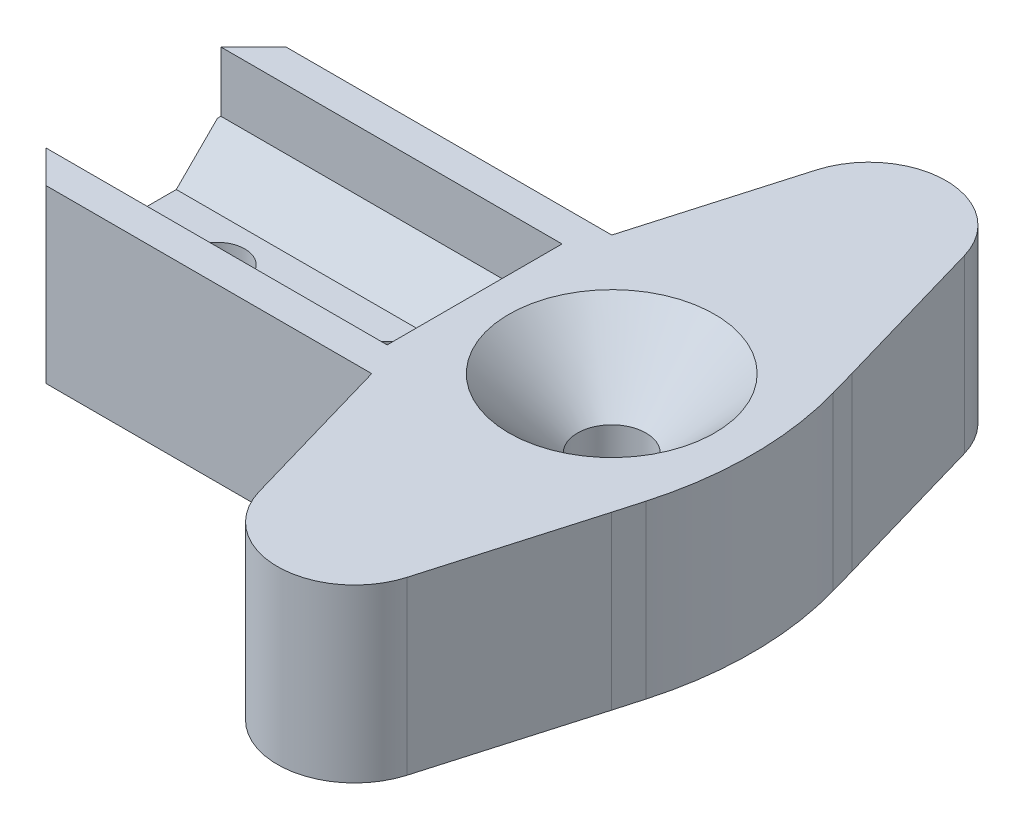
from build123d import *

# Parameters (mm, degrees)
ESQUISSE1_R             = 2
BOSS_EXTRU_1_DEPTH      = 10
ESQUISSE2_W             = 10.2
ESQUISSE2_H             = 6
ENL_V_MAT_EXTRU_1_DEPTH = 20
CHANFREIN1_SIZE         = 2.5
CHANFREIN2_SIZE         = 1.8
ESQUISSE5_R             = 1.6
ENL_V_MAT_EXTRU_4_DEPTH = 7
CHANFREIN4_SIZE         = 2.1
CHANFREIN5_SIZE         = 2
ENL_V_MAT_EXTRU_5_DEPTH = 4
CHANFREIN6_SIZE         = 4
CONG_1_R                = 20


with BuildPart() as part:
    # Esquisse1 → Boss.-Extru.1 (new body)
    with BuildSketch(Plane(origin=(0, 0, 0), x_dir=(1, 0, 0), z_dir=(0, 1, 0))):
        with BuildLine():
            Line((-28, -7), (-7, -7))
            Line((-7, -7), (-4.322606063, -16.251030305))
            ThreePointArc((-4.322606063, -16.251030305), (0, -19.5), (4.322606063, -16.251030305))
            Line((4.322606063, -16.251030305), (7, -7))
            Line((7, -7), (8.983874701, 0))
            Line((8.983874701, 0), (7, 7))
            Line((7, 7), (4.322606063, 16.251030305))
            ThreePointArc((4.322606063, 16.251030305), (0, 19.5), (-4.322606063, 16.251030305))
            Line((-4.322606063, 16.251030305), (-7, 7))
            Line((-7, 7), (-28, 7))
            Line((-28, 7), (-28, -7))
        make_face()
        with Locations(Location((0, 0, 0), (0, 0, 270))):
            Circle(ESQUISSE1_R, mode=Mode.SUBTRACT)
    extrude(amount=BOSS_EXTRU_1_DEPTH)

    # Esquisse2 → Enlèv. mat.-Extru.1 (cut)
    with BuildSketch(Plane.ZY.offset(28)):
        with Locations((0, 7)):
            Rectangle(ESQUISSE2_W, ESQUISSE2_H)
    extrude(amount=-ENL_V_MAT_EXTRU_1_DEPTH, mode=Mode.SUBTRACT)

    # Chanfrein1
    chanfrein1_edges = [part.edges().sort_by_distance(p)[0] for p in [
        (-18, 4, -5.1),
        (-18, 4, 5.1),
    ]]
    chamfer(chanfrein1_edges, length=CHANFREIN1_SIZE)

    # Chanfrein2
    chanfrein2_edges = [part.edges().sort_by_distance(p)[0] for p in [
        (-8, 4, 0),
        (-8, 5.25, -3.85),
        (-8, 5.25, 3.85),
    ]]
    chamfer(chanfrein2_edges, length=CHANFREIN2_SIZE)

    # Esquisse5 → Enlèv. mat.-Extru.4 (cut)
    with BuildSketch(Plane.XZ):
        with Locations(Location((-23, 0, 0), (0, 0, 270))):
            Circle(ESQUISSE5_R)
        with Locations(Location((-13, 0, 0), (0, 0, 270))):
            Circle(ESQUISSE5_R)
    extrude(amount=-ENL_V_MAT_EXTRU_4_DEPTH, mode=Mode.SUBTRACT)

    # Chanfrein4
    chanfrein4_edges = [part.edges().sort_by_distance(p)[0] for p in [
        (-23, 0, 1.6),
        (-13, 0, 1.6),
    ]]
    chamfer(chanfrein4_edges, length=CHANFREIN4_SIZE)

    # Chanfrein5
    chanfrein5_edges = [part.edges().sort_by_distance(p)[0] for p in [
        (-28, 5, -7),
        (-28, 5, 7),
    ]]
    chamfer(chanfrein5_edges, length=CHANFREIN5_SIZE)

    # Esquisse6 → Enlèv. mat.-Extru.5 (cut)
    with BuildSketch(Plane.XZ):
        with BuildLine():
            Line((-3.980786407, -0.391585978), (-2.500022814, -15.44473884))
            ThreePointArc((-2.500022814, -15.44473884), (0.085507989, -17.698094096), (2.487468593, -15.25))
            Line((2.487468593, -15.25), (3.979949748, -0.4))
            ThreePointArc((3.979949748, -0.4), (4, 0), (3.979949748, 0.4))
            Line((3.979949748, 0.4), (2.487468593, 15.25))
            ThreePointArc((2.487468593, 15.25), (0, 17.5), (-2.487468593, 15.25))
            Line((-2.487468593, 15.25), (-3.979949748, 0.4))
            ThreePointArc((-3.979949748, 0.4), (-3.999997766, 0.004227758), (-3.980786407, -0.391585978))
        make_face()
    extrude(amount=-ENL_V_MAT_EXTRU_5_DEPTH, mode=Mode.SUBTRACT)

    # Chanfrein6
    chanfrein6_edges = [part.edges().sort_by_distance(p)[0] for p in [
        (0, 10, -2),
    ]]
    chamfer(chanfrein6_edges, length=CHANFREIN6_SIZE)

    # Congé1
    cong_1_edges = [part.edges().sort_by_distance(p)[0] for p in [
        (8.983874701, 5, 0),
    ]]
    fillet(cong_1_edges, radius=CONG_1_R)


solid = part.part
